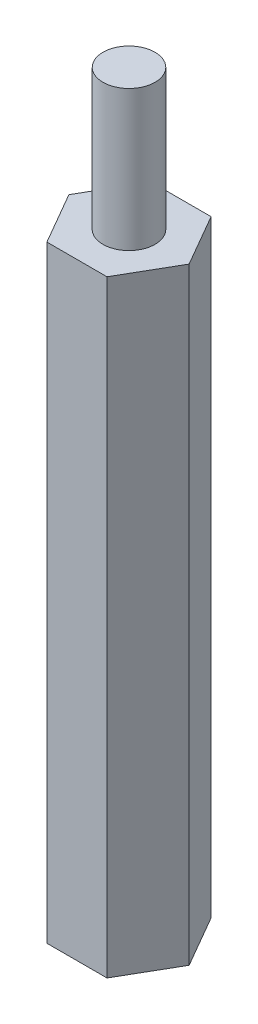
from build123d import *

# Parameters (mm, degrees)
BOSS_EXTRUDE1_DEPTH = 35
SKETCH5_R           = 1.5
BOSS_EXTRUDE2_DEPTH = 8.091605471
SKETCH6_R           = 1.5
CUT_EXTRUDE1_DEPTH  = 4


with BuildPart() as part:
    # Sketch3 → Boss-Extrude1 (new body)
    with BuildSketch(Plane(origin=(0, 0, 0), x_dir=(1, 0, 0), z_dir=(0, 1, 0))):
        Polygon((-3.464101615, 0), (-1.732050808, -3), (1.732050808, -3), (3.464101615, 0), (1.732050808, 3), (-1.732050808, 3), align=None)
    extrude(amount=BOSS_EXTRUDE1_DEPTH)

    # Sketch5 → Boss-Extrude2 (add)
    with BuildSketch(Plane(origin=(0, 35, 0), x_dir=(1, 0, 0), z_dir=(0, 1, 0))):
        with Locations(Location((0, 0, 0), (0, 0, 270))):
            Circle(SKETCH5_R)
    extrude(amount=BOSS_EXTRUDE2_DEPTH)

    # Sketch6 → Cut-Extrude1 (cut)
    with BuildSketch(Plane.XZ):
        with Locations(Location((0, 0, 0), (0, 0, 90))):
            Circle(SKETCH6_R)
    extrude(amount=-CUT_EXTRUDE1_DEPTH, mode=Mode.SUBTRACT)


solid = part.part
